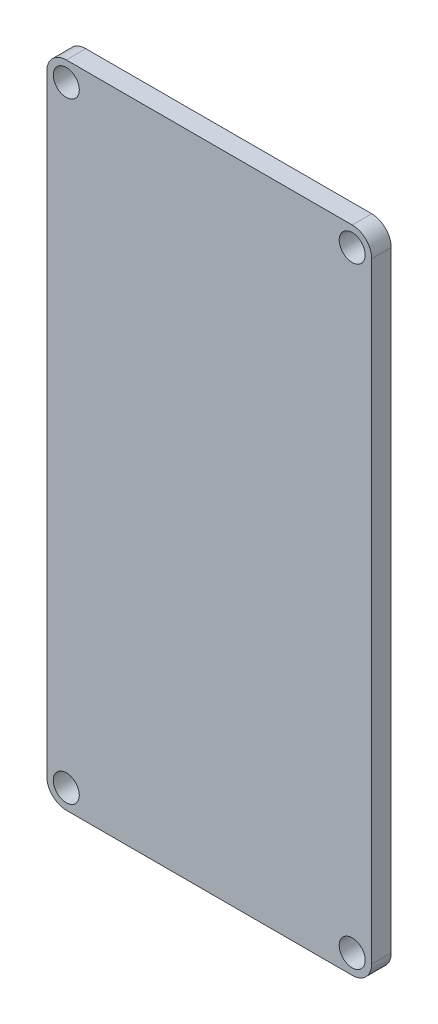
from build123d import *

# Parameters (mm, degrees)
SKETCH1_R           = 2
BOSS_EXTRUDE1_DEPTH = 3
BOSS_EXTRUDE2_DEPTH = 1


with BuildPart() as part:
    # Sketch1 → Boss-Extrude1 (new body)
    with BuildSketch(Plane.XY):
        with BuildLine():
            ThreePointArc((24.992970236, 46.999776426), (24.114290579, 49.12109677), (21.992970236, 49.999776426))
            Line((21.992970236, 49.999776426), (-22.007029764, 49.999776426))
            ThreePointArc((-22.007029764, 49.999776426), (-24.128350108, 49.12109677), (-25.007029764, 46.999776426))
            Line((-25.007029764, 46.999776426), (-25.007029764, -47.000223574))
            ThreePointArc((-25.007029764, -47.000223574), (-24.128350108, -49.121543918), (-22.007029764, -50.000223574))
            Line((-22.007029764, -50.000223574), (21.992970236, -50.000223574))
            ThreePointArc((21.992970236, -50.000223574), (24.114290579, -49.121543918), (24.992970236, -47.000223574))
            Line((24.992970236, -47.000223574), (24.992970236, 46.999776426))
        make_face()
        with Locations((-22.007029764, -47.000223574)):
            Circle(SKETCH1_R, mode=Mode.SUBTRACT)
        with Locations((21.992970236, -47.000223574)):
            Circle(SKETCH1_R, mode=Mode.SUBTRACT)
        with Locations((-22.007029764, 46.999776426)):
            Circle(SKETCH1_R, mode=Mode.SUBTRACT)
        with Locations((21.992970236, 46.999776426)):
            Circle(SKETCH1_R, mode=Mode.SUBTRACT)
    extrude(amount=BOSS_EXTRUDE1_DEPTH)

    # Sketch2 → Boss-Extrude2 (add)
    # profile 1 of 10: a face of its own
    with BuildSketch(Plane(origin=(0, 0, 0), x_dir=(-1, 0, 0), z_dir=(0, 0, -1))):
        Polygon((12.598696431, -31.164566974), (12.598696431, -29.794797009), (20.007029764, -29.794797009), (20.007029764, -30.459647436), (13.358525491, -30.459647436), (13.358525491, -31.599391026), align=None)
    # profile 2 of 10: a face of its own
    with BuildSketch(Plane(origin=(0, 0, 0), x_dir=(-1, 0, 0), z_dir=(0, 0, -1))):
        with BuildLine():
            Line((-5.266225962, 18.724358974), (-4.803205128, 18.235897436))
            add(Edge.make_bspline(
                [(-4.803205128, 18.235897436), (-4.971903871, 18.065577366), (-5.199954201, 17.791192938), (-5.447817835, 17.391240973), (-5.596713771, 17.083304474), (-5.713219294, 16.771686819), (-5.82533495, 16.365145791), (-5.862155699, 16.055732912), (-5.861538462, 15.852103365)],
                knots=[0, 0, 0, 0, 0.269020588, 0.398733209, 0.527305638, 0.652310915, 0.771699033, 1, 1, 1, 1], degree=3))
            add(Edge.make_bspline(
                [(-5.861538462, 15.852103365), (-5.863075927, 15.729137061), (-5.849688295, 15.545935219), (-5.812595923, 15.304471846), (-5.772850225, 15.126083822), (-5.722379564, 14.949606274), (-5.659273393, 14.775650852), (-5.585693358, 14.603893591), (-5.5006717, 14.435952378), (-5.407272767, 14.273137049), (-5.303769314, 14.119365455), (-5.193485184, 13.973648446), (-5.073634785, 13.838757742), (-4.945393264, 13.713796067), (-4.811070141, 13.596464936), (-4.668024469, 13.488951141), (-4.51684448, 13.393182865), (-4.361047323, 13.306700391), (-4.201954264, 13.231965386), (-4.041042366, 13.16699803), (-3.877099398, 13.117507415), (-3.711817711, 13.075624767), (-3.487830062, 13.036463316), (-3.316853438, 13.027102772), (-3.202984776, 13.025641026)],
                knots=[0, 0, 0, 0, 0.08556807, 0.12771387, 0.170061998, 0.212779251, 0.255471995, 0.298865862, 0.342847692, 0.386513065, 0.429516239, 0.471868486, 0.513710003, 0.555060853, 0.596512826, 0.637859458, 0.679560029, 0.721067725, 0.76188998, 0.801924773, 0.841812236, 0.88106488, 0.920636207, 1, 1, 1, 1], degree=3))
            add(Edge.make_bspline(
                [(-3.202984776, 13.025641026), (-3.086173477, 13.026985317), (-2.910564504, 13.036232962), (-2.68105471, 13.079865762), (-2.511483667, 13.123037788), (-2.343913649, 13.177968981), (-2.17852377, 13.24544466), (-2.015328955, 13.325829239), (-1.855949563, 13.418668377), (-1.70082789, 13.521192742), (-1.553485251, 13.633952736), (-1.415636333, 13.757138269), (-1.285267672, 13.888490637), (-1.163202026, 14.02920663), (-1.050910703, 14.180651466), (-0.94665737, 14.340705199), (-0.851587195, 14.509438828), (-0.766665588, 14.685068914), (-0.69114614, 14.865148406), (-0.628958388, 15.050256296), (-0.578253361, 15.239418092), (-0.536771211, 15.432411393), (-0.500560108, 15.697908032), (-0.486631762, 15.899590883), (-0.488461538, 16.035276442)],
                knots=[0, 0, 0, 0, 0.077886444, 0.116658333, 0.155425079, 0.194361169, 0.23400664, 0.27429462, 0.315417207, 0.356771852, 0.398060881, 0.438867116, 0.479803107, 0.521246365, 0.562815472, 0.605269167, 0.648388266, 0.691709412, 0.735133523, 0.77835607, 0.821650514, 0.865515899, 0.909726262, 1, 1, 1, 1], degree=3))
            add(Edge.make_bspline(
                [(-0.488461538, 16.035276442), (-0.488641265, 16.196937229), (-0.505024065, 16.435822878), (-0.560976531, 16.745175866), (-0.621221233, 16.963310643), (-0.697568388, 17.172112091), (-0.791958945, 17.370809918), (-0.903424841, 17.559952797), (-1.029702255, 17.738722195), (-1.170397447, 17.902867563), (-1.320864542, 18.0522609), (-1.483053908, 18.181757461), (-1.654545319, 18.295253241), (-1.836990323, 18.38898295), (-2.095952276, 18.492989964), (-2.302091674, 18.540524389), (-2.442307692, 18.561538462)],
                knots=[0, 0, 0, 0, 0.138708167, 0.204939218, 0.269469158, 0.332671241, 0.395498265, 0.457967056, 0.520866745, 0.583067903, 0.643277768, 0.702549022, 0.760882449, 0.819470671, 0.878256302, 1, 1, 1, 1], degree=3))
            Line((-2.442307692, 18.561538462), (-2.442307692, 16.444871795))
            Line((-2.442307692, 16.444871795), (-3.093589744, 16.444871795))
            Line((-3.093589744, 16.444871795), (-3.093589744, 19.131410256))
            add(Edge.make_bspline(
                [(-3.093589744, 19.131410256), (-2.856168944, 19.129868561), (-2.507074979, 19.105074476), (-2.06089694, 19.01109484), (-1.752538245, 18.917449508), (-1.463497133, 18.7960978), (-1.193484675, 18.648470208), (-0.944244102, 18.472170786), (-0.713740819, 18.273487936), (-0.508129633, 18.050512214), (-0.327414572, 17.809269105), (-0.175196592, 17.549360284), (-0.05133196, 17.271030085), (0.045243698, 16.975195659), (0.139015795, 16.547382747), (0.16188215, 16.212855954), (0.162820513, 15.985667067)],
                knots=[0, 0, 0, 0, 0.139492722, 0.204635419, 0.26740574, 0.328445598, 0.388397163, 0.447733931, 0.507391621, 0.566767555, 0.625478338, 0.684066506, 0.743248446, 0.804033357, 0.866498751, 1, 1, 1, 1], degree=3))
            add(Edge.make_bspline(
                [(0.162820513, 15.985667067), (0.162532175, 15.844276626), (0.153248108, 15.635075068), (0.122971066, 15.360744829), (0.08935861, 15.16348098), (0.04813894, 14.971278606), (-0.00463038, 14.785097344), (-0.065715632, 14.604228054), (-0.135194737, 14.428391101), (-0.215697748, 14.259182696), (-0.305159118, 14.095848393), (-0.403119975, 13.937488213), (-0.511265548, 13.785170075), (-0.628820246, 13.638140994), (-0.799351915, 13.448992951), (-0.940106679, 13.317837669), (-1.037980769, 13.234254808)],
                knots=[0, 0, 0, 0, 0.136556739, 0.202094157, 0.26646426, 0.329768823, 0.391878966, 0.453270593, 0.514114664, 0.57438951, 0.634141664, 0.693923287, 0.754152196, 0.814470164, 0.87566063, 1, 1, 1, 1], degree=3))
            add(Edge.make_bspline(
                [(-1.037980769, 13.234254808), (-1.188693729, 13.107989317), (-1.427012659, 12.937063636), (-1.769736747, 12.75593765), (-2.033831102, 12.646329019), (-2.307167328, 12.560895898), (-2.686908071, 12.477979702), (-2.980561939, 12.457371134), (-3.177544071, 12.455769231)],
                knots=[0, 0, 0, 0, 0.253668418, 0.376738432, 0.499344473, 0.621999307, 0.745698548, 1, 1, 1, 1], degree=3))
            add(Edge.make_bspline(
                [(-3.177544071, 12.455769231), (-3.326048156, 12.454037753), (-3.547202685, 12.470219282), (-3.83745942, 12.515366927), (-4.049816876, 12.564363857), (-4.258224659, 12.626243977), (-4.462781276, 12.703443348), (-4.663609889, 12.793331368), (-4.85931651, 12.897815175), (-5.04734838, 13.014054276), (-5.226785355, 13.140342424), (-5.394719302, 13.27765426), (-5.551539245, 13.426389572), (-5.699569454, 13.583550132), (-5.835717814, 13.752435278), (-5.962114786, 13.930486259), (-6.076331802, 14.119083327), (-6.178961707, 14.315250489), (-6.268929934, 14.518561303), (-6.343281094, 14.728941966), (-6.40638881, 14.9448192), (-6.452974157, 15.167827351), (-6.498973483, 15.47608349), (-6.514504684, 15.712149997), (-6.512820513, 15.871183894)],
                knots=[0, 0, 0, 0, 0.083545408, 0.124644465, 0.165304931, 0.206173076, 0.24697351, 0.288332523, 0.32999026, 0.371801673, 0.412742292, 0.453464403, 0.493832888, 0.534375408, 0.574946744, 0.615887363, 0.657245687, 0.699003207, 0.740483342, 0.782322697, 0.824565474, 0.867039742, 0.91049852, 1, 1, 1, 1], degree=3))
            add(Edge.make_bspline(
                [(-6.512820513, 15.871183894), (-6.512410807, 16.001543919), (-6.503209092, 16.196000064), (-6.472304036, 16.452287338), (-6.441083748, 16.640567205), (-6.398504896, 16.825490796), (-6.347565273, 17.007584667), (-6.288252312, 17.187112833), (-6.217515616, 17.363512692), (-6.137226704, 17.537970126), (-6.046851491, 17.711455988), (-5.944841124, 17.883374319), (-5.830905877, 18.054035635), (-5.706951579, 18.224467924), (-5.521160013, 18.451356998), (-5.372583774, 18.617467114), (-5.266225962, 18.724358974)],
                knots=[0, 0, 0, 0, 0.122179161, 0.18221627, 0.241864129, 0.300960056, 0.359969068, 0.419032918, 0.478068687, 0.537992581, 0.59896023, 0.661321079, 0.725247569, 0.791220154, 0.858745972, 1, 1, 1, 1], degree=3))
        make_face()
    # profile 3 of 10: a face of its own
    with BuildSketch(Plane(origin=(0, 0, 0), x_dir=(-1, 0, 0), z_dir=(0, 0, -1))):
        with BuildLine():
            Line((14.87818361, -11.672873932), (14.87818361, -12.337724359))
            add(Edge.make_bspline(
                [(14.87818361, -12.337724359), (14.704819904, -12.333517607), (14.450168042, -12.305700685), (14.122768231, -12.227938578), (13.894441041, -12.147392806), (13.677189564, -12.047239991), (13.471872679, -11.927167081), (13.27927474, -11.784938578), (13.101180731, -11.623634733), (12.937800787, -11.448441021), (12.796712368, -11.25941008), (12.677512028, -11.060771667), (12.577836769, -10.853127069), (12.50310958, -10.634138839), (12.427666829, -10.325332756), (12.408427454, -10.084179718), (12.408739166, -9.921705395)],
                knots=[0, 0, 0, 0, 0.135103289, 0.198978674, 0.2619043, 0.323494969, 0.385195378, 0.446969239, 0.509764777, 0.572250569, 0.633405176, 0.693251163, 0.752583163, 0.812579266, 0.873275085, 1, 1, 1, 1], degree=3))
            add(Edge.make_bspline(
                [(12.408739166, -9.921705395), (12.408244604, -9.762055221), (12.428605351, -9.527331383), (12.496214399, -9.225723365), (12.569503276, -9.0166714), (12.661583717, -8.818649693), (12.776066971, -8.634109546), (12.907568581, -8.458588756), (13.062679044, -8.300701422), (13.228182808, -8.155663212), (13.404939403, -8.030647784), (13.587710807, -7.922988085), (13.777926509, -7.834855407), (13.976199236, -7.768107435), (14.251995483, -7.701089433), (14.467103561, -7.685550502), (14.611056206, -7.683771368)],
                knots=[0, 0, 0, 0, 0.136525004, 0.200800893, 0.263983207, 0.325711145, 0.387270514, 0.449492781, 0.512955196, 0.576266397, 0.637574967, 0.697901098, 0.757558279, 0.816587504, 0.876645757, 1, 1, 1, 1], degree=3))
            add(Edge.make_bspline(
                [(14.611056206, -7.683771368), (14.81569157, -7.682875201), (15.121114769, -7.722617255), (15.510709473, -7.850166904), (15.74516473, -7.965040383), (15.93451278, -8.079047869), (16.090077285, -8.182434032), (16.256905581, -8.304373057), (16.437026145, -8.443866345), (16.62730634, -8.603773463), (16.91238073, -8.844917754), (17.123223965, -9.044978566), (17.270457916, -9.18116887)],
                knots=[0, 0, 0, 0, 0.195649413, 0.29238821, 0.391296752, 0.444816313, 0.503919104, 0.570034929, 0.642593277, 0.72196064, 0.807943598, 1, 1, 1, 1], degree=3))
            Line((17.270457916, -9.18116887), (19.247200704, -11.034736245))
            Line((19.247200704, -11.034736245), (19.247200704, -7.588792735))
            Line((19.247200704, -7.588792735), (20.007029764, -7.588792735))
            Line((20.007029764, -7.588792735), (20.007029764, -12.622660256))
            Line((20.007029764, -12.622660256), (16.941000784, -9.749556624))
            add(Edge.make_bspline(
                [(16.941000784, -9.749556624), (16.801087424, -9.61485345), (16.598191769, -9.422758624), (16.332973524, -9.184521539), (16.158170481, -9.032079481), (15.995965825, -8.901200244), (15.851620603, -8.785052139), (15.718790386, -8.691996649), (15.564822398, -8.590979531), (15.376838753, -8.493288129), (15.071489152, -8.38089219), (14.830111492, -8.348500211), (14.670417852, -8.348621795)],
                knots=[0, 0, 0, 0, 0.212829202, 0.30610131, 0.390647321, 0.466924469, 0.534481039, 0.593586941, 0.644557005, 0.736200453, 0.825024026, 1, 1, 1, 1], degree=3))
            add(Edge.make_bspline(
                [(14.670417852, -8.348621795), (14.570762017, -8.348092251), (14.423239008, -8.363438985), (14.233289412, -8.411445401), (14.097126498, -8.462066002), (13.967066718, -8.528984253), (13.842950665, -8.610414873), (13.722959053, -8.704375149), (13.610451167, -8.813068299), (13.507409537, -8.93247278), (13.4161293, -9.058613928), (13.339849882, -9.192069943), (13.27730353, -9.332278371), (13.228296755, -9.478847301), (13.182033144, -9.686280832), (13.168982051, -9.847004309), (13.168568226, -9.955838341)],
                knots=[0, 0, 0, 0, 0.122121906, 0.180988497, 0.239933216, 0.299905831, 0.359988847, 0.421775742, 0.486575826, 0.551534805, 0.615017543, 0.677258617, 0.739729962, 0.803050103, 0.866495132, 1, 1, 1, 1], degree=3))
            add(Edge.make_bspline(
                [(13.168568226, -9.955838341), (13.168688845, -10.069694703), (13.182632348, -10.237466312), (13.227326276, -10.454478743), (13.279341348, -10.60566631), (13.340874719, -10.751158089), (13.419025321, -10.887849673), (13.509843255, -11.018010106), (13.615148939, -11.139498723), (13.733467892, -11.25045617), (13.863863338, -11.349318847), (14.005397158, -11.435127113), (14.157486486, -11.510116069), (14.321653206, -11.570919298), (14.561296412, -11.634699016), (14.749252475, -11.663695443), (14.87818361, -11.672873932)],
                knots=[0, 0, 0, 0, 0.126529667, 0.186743667, 0.245897683, 0.304053107, 0.362195516, 0.420654639, 0.480330856, 0.540662876, 0.600743511, 0.661981857, 0.724480055, 0.789067141, 0.856333337, 1, 1, 1, 1], degree=3))
        make_face()
    # profile 4 of 10: a face of its own
    with BuildSketch(Plane(origin=(0, 0, 0), x_dir=(-1, 0, 0), z_dir=(0, 0, -1))):
        with BuildLine():
            Line((14.308311815, 8.443600427), (14.308311815, 7.77875))
            add(Edge.make_bspline(
                [(14.308311815, 7.77875), (14.161440392, 7.80984247), (13.95066502, 7.876212534), (13.682556572, 7.985485601), (13.500299974, 8.081483455), (13.329280732, 8.186296391), (13.173346417, 8.306354434), (13.02853935, 8.436149179), (12.900029475, 8.579711637), (12.783660327, 8.730267396), (12.684440157, 8.889937318), (12.599092123, 9.055509112), (12.528758157, 9.228129924), (12.475854787, 9.408313595), (12.423653699, 9.659440097), (12.407750135, 9.853339116), (12.408739166, 9.984035123)],
                knots=[0, 0, 0, 0, 0.141976611, 0.208984928, 0.27395687, 0.336889347, 0.398744953, 0.460115885, 0.520824923, 0.580994459, 0.640151928, 0.698622451, 0.757271081, 0.816426694, 0.876254048, 1, 1, 1, 1], degree=3))
            add(Edge.make_bspline(
                [(12.408739166, 9.984035123), (12.407668028, 10.175273444), (12.441088762, 10.460510833), (12.553730687, 10.824017197), (12.668892125, 11.08201546), (12.811142427, 11.321660512), (12.980391671, 11.534888449), (13.173432468, 11.718791336), (13.386649784, 11.873125493), (13.614518223, 11.993785638), (13.925277035, 12.112519153), (14.17118262, 12.147224199), (14.333540515, 12.147767094)],
                knots=[0, 0, 0, 0, 0.178539792, 0.266093034, 0.354630978, 0.441886153, 0.525746915, 0.608113634, 0.690197273, 0.770821484, 0.848326181, 1, 1, 1, 1], degree=3))
            add(Edge.make_bspline(
                [(14.333540515, 12.147767094), (14.486516031, 12.147461699), (14.71429381, 12.124307517), (14.99983936, 12.030621521), (15.198778335, 11.935322306), (15.384395325, 11.811769711), (15.620986279, 11.60756118), (15.769335347, 11.418668859), (15.857650758, 11.282571114)],
                knots=[0, 0, 0, 0, 0.250608319, 0.370630166, 0.490072247, 0.610374764, 0.73431307, 1, 1, 1, 1], degree=3))
            add(Edge.make_bspline(
                [(15.857650758, 11.282571114), (15.926534596, 11.442081264), (16.107015654, 11.738278257), (16.351913504, 11.984052732), (16.48985228, 12.085437366)],
                knots=[0, 0, 0, 0, 0.50389613, 1, 1, 1, 1], degree=3))
            add(Edge.make_bspline(
                [(16.48985228, 12.085437366), (16.584286285, 12.159616271), (16.736937083, 12.252219503), (16.948537088, 12.358202576), (17.111810035, 12.419986812), (17.279193403, 12.467701449), (17.509712114, 12.513805079), (17.687030012, 12.527035987), (17.806196765, 12.527681624)],
                knots=[0, 0, 0, 0, 0.254172712, 0.378111645, 0.501712263, 0.623986309, 0.747095614, 1, 1, 1, 1], degree=3))
            add(Edge.make_bspline(
                [(17.806196765, 12.527681624), (18.013369741, 12.529289024), (18.324763247, 12.483827427), (18.721624466, 12.343360994), (19.007656983, 12.194555993), (19.275015931, 12.012077365), (19.516001349, 11.797463089), (19.719884395, 11.547556778), (19.892339274, 11.271436024), (20.028754483, 10.971005095), (20.162425314, 10.538447925), (20.196509929, 10.195376156), (20.196987029, 9.964742588)],
                knots=[0, 0, 0, 0, 0.15890809, 0.239599009, 0.322581849, 0.405999924, 0.487842619, 0.569675599, 0.653019991, 0.737412348, 0.822558452, 1, 1, 1, 1], degree=3))
            add(Edge.make_bspline(
                [(20.196987029, 9.964742588), (20.195086446, 9.809191413), (20.183469296, 9.578119941), (20.121020564, 9.282209539), (20.063267741, 9.072670373), (19.983364136, 8.875047987), (19.888116655, 8.686508321), (19.775069109, 8.507875612), (19.644035028, 8.340211161), (19.497361666, 8.183694433), (19.332612991, 8.042311132), (19.152862344, 7.914504164), (18.956498172, 7.801057986), (18.744049647, 7.701603697), (18.431002662, 7.587266952), (18.18355488, 7.523914268), (18.012478482, 7.493814103)],
                knots=[0, 0, 0, 0, 0.128956388, 0.190367128, 0.249965467, 0.308568754, 0.366415243, 0.424556413, 0.483181137, 0.542251435, 0.60174426, 0.662507715, 0.724499557, 0.789138915, 0.856353952, 1, 1, 1, 1], degree=3))
            Line((18.012478482, 7.493814103), (18.012478482, 8.15866453))
            add(Edge.make_bspline(
                [(18.012478482, 8.15866453), (18.123426911, 8.191933768), (18.285672611, 8.242670323), (18.486534672, 8.332374456), (18.620714279, 8.402442238), (18.743908409, 8.476118697), (18.886576756, 8.583338267), (18.9828537, 8.672426316), (19.036466863, 8.738924613)],
                knots=[0, 0, 0, 0, 0.29131641, 0.425966373, 0.552159574, 0.671527414, 0.786121629, 1, 1, 1, 1], degree=3))
            add(Edge.make_bspline(
                [(19.036466863, 8.738924613), (19.102293608, 8.820115028), (19.191039181, 8.950974339), (19.283849963, 9.140560261), (19.340746734, 9.291558575), (19.383348471, 9.451280623), (19.425399876, 9.679426507), (19.438153771, 9.856470557), (19.437157969, 9.976614917)],
                knots=[0, 0, 0, 0, 0.236155811, 0.355630221, 0.476249447, 0.60016412, 0.728633077, 1, 1, 1, 1], degree=3))
            add(Edge.make_bspline(
                [(19.437157969, 9.976614917), (19.437917328, 10.11224667), (19.422521824, 10.311055148), (19.37567104, 10.567507825), (19.322998425, 10.74398172), (19.257830361, 10.911050984), (19.176028562, 11.066375567), (19.080047851, 11.211993931), (18.970956917, 11.346041327), (18.851531327, 11.466575442), (18.726620412, 11.572705977), (18.596750333, 11.662921477), (18.461203824, 11.735724172), (18.320537168, 11.793104776), (18.12455297, 11.846004167), (17.972456977, 11.864896986), (17.870010533, 11.862831197)],
                knots=[0, 0, 0, 0, 0.148751715, 0.218402794, 0.285759581, 0.350598024, 0.414964045, 0.478069339, 0.541760676, 0.604349859, 0.664075021, 0.721463623, 0.777587128, 0.832644447, 0.887843511, 1, 1, 1, 1], degree=3))
            add(Edge.make_bspline(
                [(17.870010533, 11.862831197), (17.732475475, 11.862101587), (17.524470406, 11.831091177), (17.265273991, 11.722060387), (17.079796239, 11.610038534), (16.909985159, 11.470140667), (16.757391071, 11.309190532), (16.631597196, 11.122751695), (16.544604986, 10.951287854), (16.485262953, 10.799380857), (16.445733402, 10.669385927), (16.41226204, 10.523850806), (16.381118193, 10.364537193), (16.354626457, 10.190243737), (16.323996858, 9.928790886), (16.310021227, 9.724525042), (16.302863097, 9.583344017)],
                knots=[0, 0, 0, 0, 0.13348033, 0.20102742, 0.271634404, 0.34290514, 0.413858569, 0.4859963, 0.560246393, 0.599899498, 0.644068466, 0.691903727, 0.744697298, 0.801499375, 0.862862948, 1, 1, 1, 1], degree=3))
            Line((16.302863097, 9.583344017), (15.543034038, 9.583344017))
            add(Edge.make_bspline(
                [(15.543034038, 9.583344017), (15.543719085, 9.762670678), (15.523810346, 10.02746665), (15.449941455, 10.367305327), (15.372747528, 10.601330098), (15.28171232, 10.814223873), (15.176549905, 10.999671467), (15.057517574, 11.152775725), (14.926898631, 11.275187827), (14.787575674, 11.368103069), (14.593408817, 11.457476477), (14.435130181, 11.482154542), (14.330572432, 11.482916667)],
                knots=[0, 0, 0, 0, 0.215728893, 0.318103522, 0.417657931, 0.51174192, 0.596260228, 0.673404587, 0.744145217, 0.810661996, 0.874048981, 1, 1, 1, 1], degree=3))
            add(Edge.make_bspline(
                [(14.330572432, 11.482916667), (14.253458575, 11.484791541), (14.139191591, 11.46917284), (13.992714187, 11.42582541), (13.888046394, 11.379313563), (13.787868708, 11.318933997), (13.691077686, 11.24613476), (13.598925269, 11.158807272), (13.510935612, 11.061001868), (13.430889595, 10.952698723), (13.36083534, 10.836424926), (13.301410492, 10.712651823), (13.252234687, 10.582172024), (13.215323818, 10.444378619), (13.179116766, 10.248314746), (13.169142433, 10.096133431), (13.168568226, 9.99293937)],
                knots=[0, 0, 0, 0, 0.109957746, 0.163912222, 0.218089001, 0.273309497, 0.330913549, 0.390994211, 0.454640742, 0.518898068, 0.583342166, 0.648543366, 0.715052521, 0.782518585, 0.852333896, 1, 1, 1, 1], degree=3))
            add(Edge.make_bspline(
                [(13.168568226, 9.99293937), (13.168179224, 9.8284048), (13.198217286, 9.585770923), (13.308129235, 9.285491976), (13.403978668, 9.116715622), (13.498714628, 8.992080432), (13.58143587, 8.903017327), (13.673370178, 8.815557001), (13.780170863, 8.735444443), (13.894622911, 8.654454918), (14.070070771, 8.553115599), (14.210128303, 8.485411033), (14.308311815, 8.443600427)],
                knots=[0, 0, 0, 0, 0.239684964, 0.351815855, 0.463766133, 0.520817793, 0.579448291, 0.640604145, 0.705297512, 0.773633881, 0.844669382, 1, 1, 1, 1], degree=3))
        make_face()
    # profile 5 of 10: a face of its own
    with BuildSketch(Plane(origin=(0, 0, 0), x_dir=(-1, 0, 0), z_dir=(0, 0, -1))):
        Polygon((12.408739166, 31.654300548), (12.408739166, 31.789348291), (17.53758532, 31.789348291), (17.53758532, 32.644155983), (18.297414379, 32.644155983), (18.297414379, 31.789348291), (20.007029764, 31.789348291), (20.007029764, 31.124497863), (18.297414379, 31.124497863), (18.297414379, 27.610288462), align=None)
        Polygon((17.53758532, 31.124497863), (14.323152227, 31.124497863), (17.53758532, 28.917728699), align=None, mode=Mode.SUBTRACT)
    # profile 6 of 10: a face of its own
    with BuildSketch(Plane(origin=(0, 0, 0), x_dir=(-1, 0, 0), z_dir=(0, 0, -1))):
        Polygon((-6.35, 1.058333333), (-6.35, 1.628205128), (-0.651282051, 1.628205128), (-0.651282051, 4.070512821), (0, 4.070512821), (0, 1.058333333), align=None)
    # profile 7 of 10: a face of its own
    with BuildSketch(Plane(origin=(0, 0, 0), x_dir=(-1, 0, 0), z_dir=(0, 0, -1))):
        Polygon((-6.35, -2.849358974), (0, 0.081410256), (0, -0.538070913), (-2.03525641, -1.476832933), (-2.03525641, -4.355448718), (0, -5.319651442), (0, -5.942948718), (-6.35, -2.930769231), align=None)
        Polygon((-5.11103766, -2.896424279), (-2.686538462, -4.045072115), (-2.686538462, -1.777033253), align=None, mode=Mode.SUBTRACT)
    # profile 8 of 10: a face of its own
    with BuildSketch(Plane(origin=(0, 0, 0), x_dir=(-1, 0, 0), z_dir=(0, 0, -1))):
        Polygon((0, -11.967307692), (-6.35, -11.967307692), (-6.35, -11.847736378), (-1.352173478, -7.652564103), (-6.35, -7.652564103), (-6.35, -7.082692308), (0, -7.082692308), (0, -7.212439904), (-4.986378205, -11.397435897), (0, -11.397435897), align=None)
    # profile 9 of 10: a face of its own
    with BuildSketch(Plane(origin=(0, 0, 0), x_dir=(-1, 0, 0), z_dir=(0, 0, -1))):
        Polygon((-6.35, -15.875), (0, -12.944230769), (0, -13.563711939), (-2.03525641, -14.502473958), (-2.03525641, -17.381089744), (0, -18.345292468), (0, -18.968589744), (-6.35, -15.956410256), align=None)
        Polygon((-5.11103766, -15.922065304), (-2.686538462, -17.070713141), (-2.686538462, -14.802674279), align=None, mode=Mode.SUBTRACT)
    # profile 10 of 10: a face of its own
    with BuildSketch(Plane(origin=(0, 0, 0), x_dir=(-1, 0, 0), z_dir=(0, 0, -1))):
        with BuildLine():
            add(Edge.make_bspline(
                [(-6.512820513, 8.100320513), (-6.512147156, 8.331114767), (-6.485536819, 8.67327494), (-6.383743104, 9.112739465), (-6.278141551, 9.423256394), (-6.141089788, 9.718385345), (-5.974649476, 9.998954663), (-5.777767476, 10.264124819), (-5.553346025, 10.512070439), (-5.307567203, 10.738253517), (-5.044456489, 10.936733185), (-4.767321703, 11.104159246), (-4.476148275, 11.241253348), (-4.171616655, 11.348740906), (-3.73981816, 11.449633986), (-3.404357449, 11.479296546), (-3.177544071, 11.478846154)],
                knots=[0, 0, 0, 0, 0.130742119, 0.193347802, 0.254998325, 0.316119246, 0.37726421, 0.439399947, 0.502805226, 0.566356248, 0.628250785, 0.689107071, 0.749357939, 0.810179643, 0.871616622, 1, 1, 1, 1], degree=3))
            add(Edge.make_bspline(
                [(-3.177544071, 11.478846154), (-2.952440817, 11.479275478), (-2.619008563, 11.449648491), (-2.190073905, 11.34840961), (-1.885984659, 11.242585769), (-1.595402506, 11.1053863), (-1.318057949, 10.937713822), (-1.054244462, 10.739610817), (-0.80677241, 10.514388235), (-0.580393505, 10.268141187), (-0.380715855, 10.00604163), (-0.213216266, 9.728914452), (-0.074594341, 9.439630096), (0.030660579, 9.135922528), (0.13488598, 8.708890274), (0.162713245, 8.375733318), (0.162820513, 8.151201923)],
                knots=[0, 0, 0, 0, 0.128584338, 0.190343089, 0.251407985, 0.312205577, 0.373614079, 0.43626401, 0.500407259, 0.56453495, 0.627137084, 0.688338311, 0.749239593, 0.810075787, 0.871655612, 1, 1, 1, 1], degree=3))
            add(Edge.make_bspline(
                [(0.162820513, 8.151201923), (0.163291211, 7.924398568), (0.133532884, 7.588495699), (0.032596203, 7.156491537), (-0.073439994, 6.850758937), (-0.210662272, 6.558940128), (-0.377938955, 6.280465293), (-0.576437076, 6.016452019), (-0.801710081, 5.769088957), (-1.046950071, 5.542758945), (-1.309720736, 5.345435923), (-1.584867114, 5.178122094), (-1.873152479, 5.041358865), (-2.17318405, 4.933232456), (-2.596611535, 4.832949824), (-2.925204975, 4.802499219), (-3.147015224, 4.803205128)],
                knots=[0, 0, 0, 0, 0.129746527, 0.192071954, 0.253459424, 0.314569588, 0.376279881, 0.439025654, 0.503267029, 0.567492823, 0.629704796, 0.690999649, 0.751451651, 0.812004364, 0.873149681, 1, 1, 1, 1], degree=3))
            add(Edge.make_bspline(
                [(-3.147015224, 4.803205128), (-3.297192884, 4.801536364), (-3.520927795, 4.817535091), (-3.814907293, 4.863044867), (-4.030030165, 4.911234919), (-4.240416178, 4.974376467), (-4.447518369, 5.048851334), (-4.649237386, 5.139820759), (-4.846528975, 5.242655265), (-5.036317602, 5.357430363), (-5.215713418, 5.48420491), (-5.386221797, 5.618526228), (-5.543424219, 5.765779812), (-5.691893851, 5.921112506), (-5.829349073, 6.087044134), (-5.957029313, 6.262562207), (-6.072092038, 6.448421951), (-6.176157501, 6.640043687), (-6.265461451, 6.837577238), (-6.342102507, 7.038339991), (-6.404245066, 7.243271563), (-6.453214758, 7.451830343), (-6.498378351, 7.736991398), (-6.514550403, 7.954352285), (-6.512820513, 8.100320513)],
                knots=[0, 0, 0, 0, 0.085872872, 0.128120007, 0.170151964, 0.211917621, 0.253753003, 0.296006409, 0.338443357, 0.381015368, 0.422820479, 0.464089056, 0.505125849, 0.545974971, 0.586985211, 0.628338592, 0.670083802, 0.711991602, 0.753039155, 0.794049395, 0.834885543, 0.875498313, 0.9165473, 1, 1, 1, 1], degree=3))
        make_face()
        with BuildLine():
            add(Edge.make_bspline(
                [(-5.861538462, 8.128305288), (-5.863216116, 8.008283989), (-5.84956311, 7.829328385), (-5.812693139, 7.593778969), (-5.773098168, 7.420394921), (-5.72178249, 7.249280671), (-5.659917525, 7.080357778), (-5.58513742, 6.914206091), (-5.501039908, 6.751032999), (-5.405518092, 6.594607315), (-5.304083378, 6.444552308), (-5.192966766, 6.304771039), (-5.074571361, 6.173343302), (-4.947869663, 6.050595949), (-4.813693742, 5.936583112), (-4.671463246, 5.831398324), (-4.521763521, 5.736307294), (-4.365430355, 5.651684121), (-4.20545223, 5.575915886), (-4.039948824, 5.513112616), (-3.869953849, 5.463341773), (-3.696212971, 5.421178801), (-3.456074265, 5.385188283), (-3.27300718, 5.371131013), (-3.149559295, 5.373076923)],
                knots=[0, 0, 0, 0, 0.083632194, 0.124964793, 0.166222185, 0.207584406, 0.249507546, 0.291611843, 0.33460641, 0.377469534, 0.41939163, 0.46087318, 0.501919046, 0.542707274, 0.583836179, 0.624654424, 0.666009241, 0.707436977, 0.74858821, 0.78940324, 0.830765461, 0.872089593, 0.914006472, 1, 1, 1, 1], degree=3))
            add(Edge.make_bspline(
                [(-3.149559295, 5.373076923), (-2.969092238, 5.372492404), (-2.702099651, 5.397631905), (-2.358428402, 5.481531546), (-2.115563354, 5.570933531), (-1.883188518, 5.685138883), (-1.662208152, 5.824406187), (-1.452687517, 5.990054359), (-1.256186042, 6.178102611), (-1.076903463, 6.383729184), (-0.919310601, 6.601969494), (-0.786685196, 6.831097125), (-0.675779613, 7.069791457), (-0.592352007, 7.320090154), (-0.511421802, 7.671485403), (-0.486926269, 7.944117705), (-0.488461538, 8.128305288)],
                knots=[0, 0, 0, 0, 0.1268942, 0.187738963, 0.248419712, 0.308585774, 0.369580252, 0.4318217, 0.49617186, 0.56065739, 0.623491454, 0.685244918, 0.746642893, 0.808335087, 0.870491415, 1, 1, 1, 1], degree=3))
            add(Edge.make_bspline(
                [(-0.488461538, 8.128305288), (-0.487923833, 8.252833989), (-0.498659306, 8.438753472), (-0.535909509, 8.682765931), (-0.575793582, 8.861016879), (-0.625118632, 9.03584561), (-0.686282972, 9.206724398), (-0.759609121, 9.373596543), (-0.841327475, 9.537282577), (-0.934157656, 9.694117415), (-1.034224945, 9.843262222), (-1.143380942, 9.98280267), (-1.260186248, 10.114168743), (-1.386498465, 10.236055845), (-1.51985895, 10.349744063), (-1.662391314, 10.453110178), (-1.811477906, 10.547878841), (-1.966671303, 10.633534577), (-2.127089261, 10.707111135), (-2.29187154, 10.769941735), (-2.461138693, 10.820609993), (-2.634511915, 10.860260418), (-2.873465107, 10.897355549), (-3.055848401, 10.910591349), (-3.178816106, 10.908974359)],
                knots=[0, 0, 0, 0, 0.086549109, 0.129194252, 0.171458774, 0.213443842, 0.25539786, 0.2975069, 0.340083742, 0.382496006, 0.424106943, 0.464848603, 0.505555064, 0.546201722, 0.586772432, 0.62727456, 0.668485841, 0.709511189, 0.750395471, 0.791068838, 0.832005148, 0.873119342, 0.914599582, 1, 1, 1, 1], degree=3))
            add(Edge.make_bspline(
                [(-3.178816106, 10.908974359), (-3.300935612, 10.910580627), (-3.482062781, 10.89737896), (-3.719303931, 10.860230612), (-3.891052283, 10.820807535), (-4.058145016, 10.769900526), (-4.220427044, 10.707153474), (-4.3785025, 10.633156167), (-4.531980587, 10.548232888), (-4.679255286, 10.452773031), (-4.820046258, 10.348460721), (-4.951721325, 10.2335029), (-5.077486672, 10.111154015), (-5.194826729, 9.978472523), (-5.303288124, 9.835435273), (-5.407757727, 9.685603704), (-5.500214597, 9.52558949), (-5.586025421, 9.361041445), (-5.659236798, 9.192041408), (-5.722109229, 9.021002782), (-5.773251221, 8.847242334), (-5.812541278, 8.67083992), (-5.849623349, 8.431515234), (-5.863184684, 8.25001046), (-5.861538462, 8.128305288)],
                knots=[0, 0, 0, 0, 0.085122966, 0.126462912, 0.167439259, 0.20795922, 0.248228951, 0.288726228, 0.32964273, 0.370506798, 0.411094735, 0.451781735, 0.49236536, 0.533441965, 0.575215728, 0.617556523, 0.660784041, 0.704048997, 0.746972782, 0.789181087, 0.83111794, 0.87324842, 0.91517275, 1, 1, 1, 1], degree=3))
        make_face(mode=Mode.SUBTRACT)
    extrude(amount=BOSS_EXTRUDE2_DEPTH)


solid = part.part
